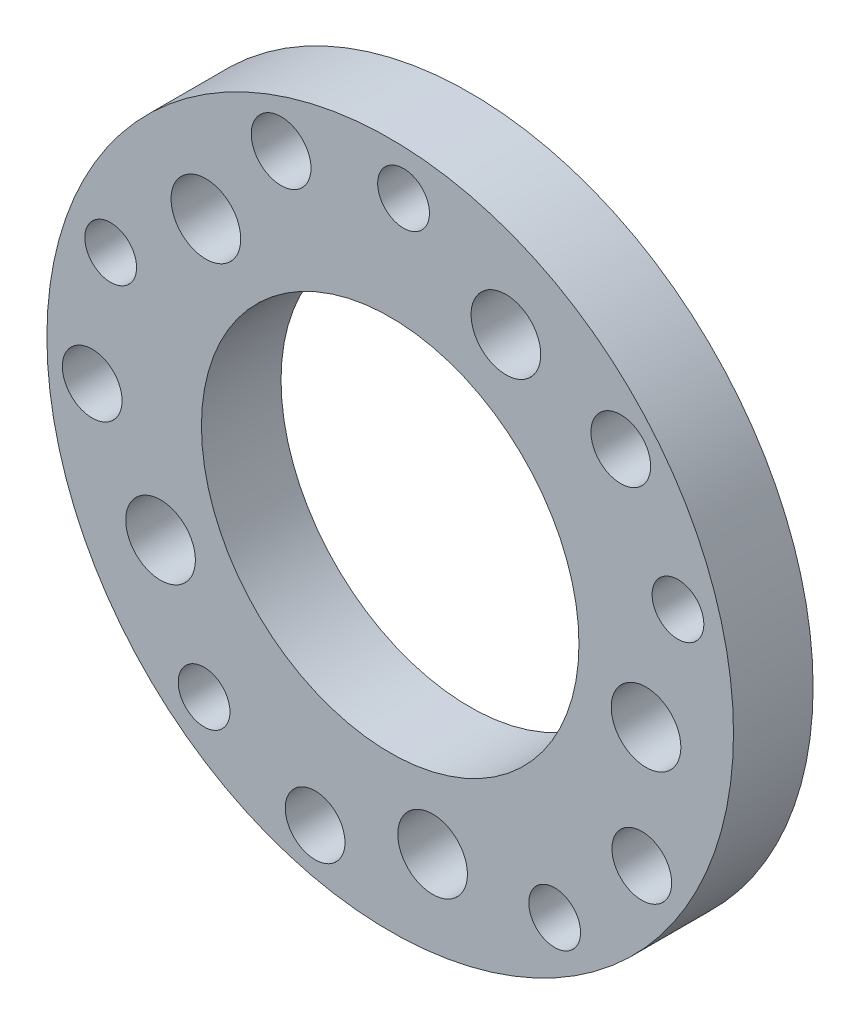
from build123d import *

# Parameters (mm, degrees)
SKETCH_1_R      = 17.25
SKETCH_1_R_2    = 9.485
SKETCH_1_R_3    = 1.3
SKETCH_1_R_4    = 1.5
SKETCH_1_R_5    = 1.75
EXTRUDE_1_DEPTH = 4


with BuildPart() as part:
    # 草图1 → 凸台-拉伸1 (new body)
    with BuildSketch(Plane.XY):
        Circle(SKETCH_1_R)
        Circle(SKETCH_1_R_2, mode=Mode.SUBTRACT)
        with Locations((8.264326198, -12.518023506)):
            Circle(SKETCH_1_R_3, mode=Mode.SUBTRACT)
        with Locations((-9.351530584, -11.728123283)):
            Circle(SKETCH_1_R_3, mode=Mode.SUBTRACT)
        with Locations((-14.043889946, 5.269644693)):
            Circle(SKETCH_1_R_3, mode=Mode.SUBTRACT)
        with Locations((0.671929263, 14.984942812)):
            Circle(SKETCH_1_R_3, mode=Mode.SUBTRACT)
        with Locations((14.459165069, 3.991559284)):
            Circle(SKETCH_1_R_3, mode=Mode.SUBTRACT)
        with Locations((11.585591146, 9.527543115)):
            Circle(SKETCH_1_R_4, mode=Mode.SUBTRACT)
        with Locations((12.641376517, -8.074379217)):
            Circle(SKETCH_1_R_4, mode=Mode.SUBTRACT)
        with Locations((-3.772790794, -14.517783909)):
            Circle(SKETCH_1_R_4, mode=Mode.SUBTRACT)
        with Locations((-14.97308946, -0.89810468)):
            Circle(SKETCH_1_R_4, mode=Mode.SUBTRACT)
        with Locations((-5.481087409, 13.962724691)):
            Circle(SKETCH_1_R_4, mode=Mode.SUBTRACT)
        with Locations((5.814261494, 11.627311094)):
            Circle(SKETCH_1_R_5, mode=Mode.SUBTRACT)
        with Locations((12.854935594, -1.936654554)):
            Circle(SKETCH_1_R_5, mode=Mode.SUBTRACT)
        with Locations((2.130525627, -12.824229433)):
            Circle(SKETCH_1_R_5, mode=Mode.SUBTRACT)
        with Locations((-11.538198343, -5.989155115)):
            Circle(SKETCH_1_R_5, mode=Mode.SUBTRACT)
        with Locations((-9.261524372, 9.122728008)):
            Circle(SKETCH_1_R_5, mode=Mode.SUBTRACT)
    extrude(amount=EXTRUDE_1_DEPTH)


solid = part.part
